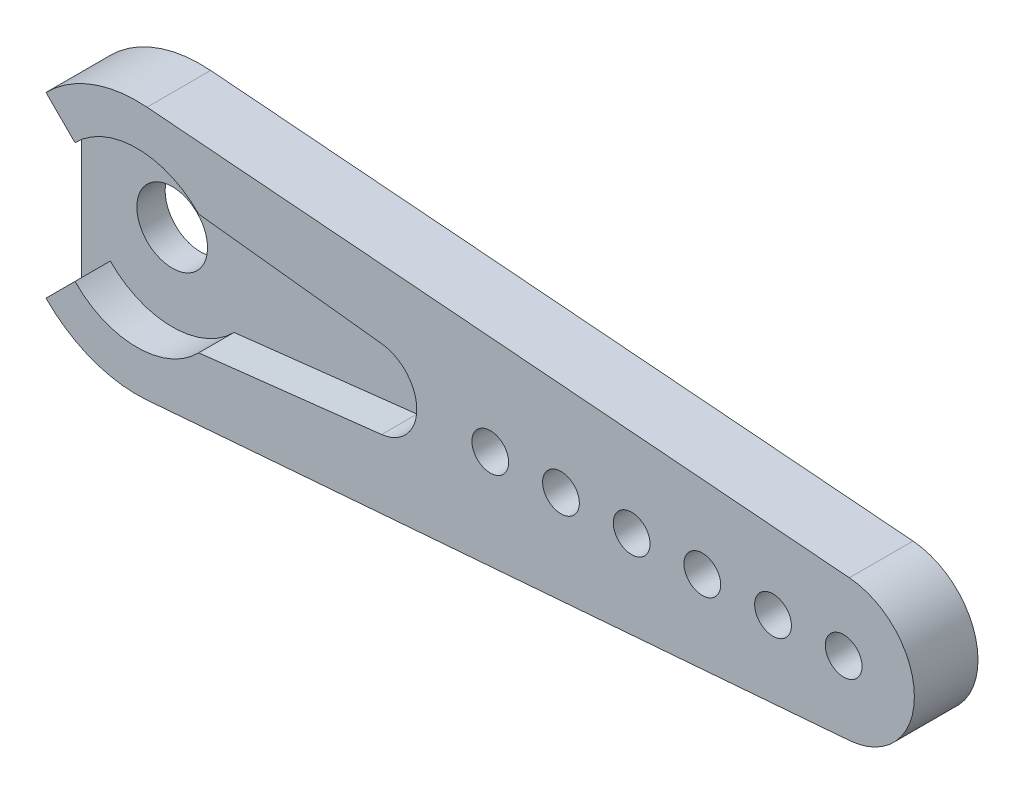
from build123d import *

# Parameters (mm, degrees)
MAIN_DEPTH            = 2.5
ORIGINALBRACKET_START = 2
ESQUISSE2_R           = 2.5
ORIGINALBRACKET_DEPTH = 2
ESQUISSE3_R           = 1.3
FIXINGHOLE_DEPTH      = 56.91287866
LPATTERN1_COUNT       = 6
LPATTERN1_PITCH       = 5


with BuildPart() as part:
    # Esquisse1 → Main (new body)
    with BuildSketch(Plane.XY):
        with BuildLine():
            Line((-4.375785644, 4.25), (-6.426543071, 6.300757427))
            ThreePointArc((-6.426543071, 6.300757427), (-3.150224217, 8.43066352), (0.72, 8.971153772))
            Line((0.72, 8.971153772), (50.4, 4.983974318))
            ThreePointArc((50.4, 4.983974318), (55, 0), (50.4, -4.983974318))
            Line((50.4, -4.983974318), (0.72, -8.971153772))
            ThreePointArc((0.72, -8.971153772), (-3.150224217, -8.43066352), (-6.426543071, -6.300757427))
            Line((-6.426543071, -6.300757427), (-4.375785644, -4.25))
            ThreePointArc((-4.375785644, -4.25), (0, -6.1), (4.375785644, -4.25))
            Line((4.375785644, -4.25), (17.31559729, -2.78215714))
            ThreePointArc((17.31559729, -2.78215714), (19.8, 0), (17.31559729, 2.78215714))
            Line((17.31559729, 2.78215714), (4.375785644, 4.25))
            ThreePointArc((4.375785644, 4.25), (0, 6.1), (-4.375785644, 4.25))
        make_face()
    extrude(amount=MAIN_DEPTH)

    # Esquisse2 → OriginalBracket (add)
    with BuildSketch(Plane(origin=(0, 0, 0), x_dir=(-1, 0, 0), z_dir=(0, 0, -1)).offset(ORIGINALBRACKET_START)):
        with BuildLine():
            Line((-0.72, -8.971153772), (-50.4, -4.983974318))
            ThreePointArc((-50.4, -4.983974318), (-55, 0), (-50.4, 4.983974318))
            Line((-50.4, 4.983974318), (-0.72, 8.971153772))
            ThreePointArc((-0.72, 8.971153772), (3.150224217, 8.43066352), (6.426543071, 6.300757427))
            Line((6.426543071, 6.300757427), (6.426543071, -6.300757427))
            ThreePointArc((6.426543071, -6.300757427), (3.150224217, -8.43066352), (-0.72, -8.971153772))
        make_face()
        Circle(ESQUISSE2_R, mode=Mode.SUBTRACT)
    extrude(amount=-ORIGINALBRACKET_DEPTH)

    # Esquisse3 → FixingHole (cut, through all)
    with BuildSketch(Plane.XY.offset(2.5)):
        with Locations((50, 0)):
            Circle(ESQUISSE3_R)
    fixinghole = extrude(amount=-FIXINGHOLE_DEPTH, mode=Mode.SUBTRACT)

    # LPattern1: FixingHole ×6
    with Locations(*[(-i * LPATTERN1_PITCH, 0, 0) for i in range(1, LPATTERN1_COUNT)]):
        add(fixinghole, mode=Mode.SUBTRACT)


solid = part.part
